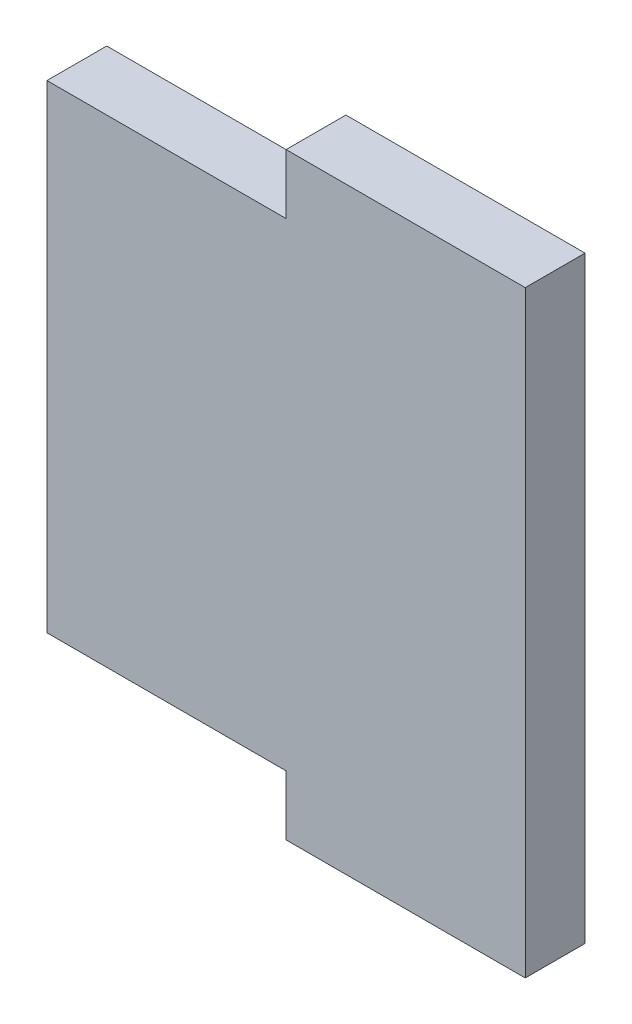
from build123d import *

# Parameters (mm, degrees)
BOSS_EXTRUDE1_DEPTH = 3.175


with BuildPart() as part:
    # Sketch1 → Boss-Extrude1 (new body)
    with BuildSketch(Plane.XY):
        Polygon((212.725, 0), (200.025, 0), (200.025, -3.175), (187.325, -3.175), (187.325, -28.575), (200.025, -28.575), (200.025, -31.75), (212.725, -31.75), align=None)
    extrude(amount=BOSS_EXTRUDE1_DEPTH)


solid = part.part
